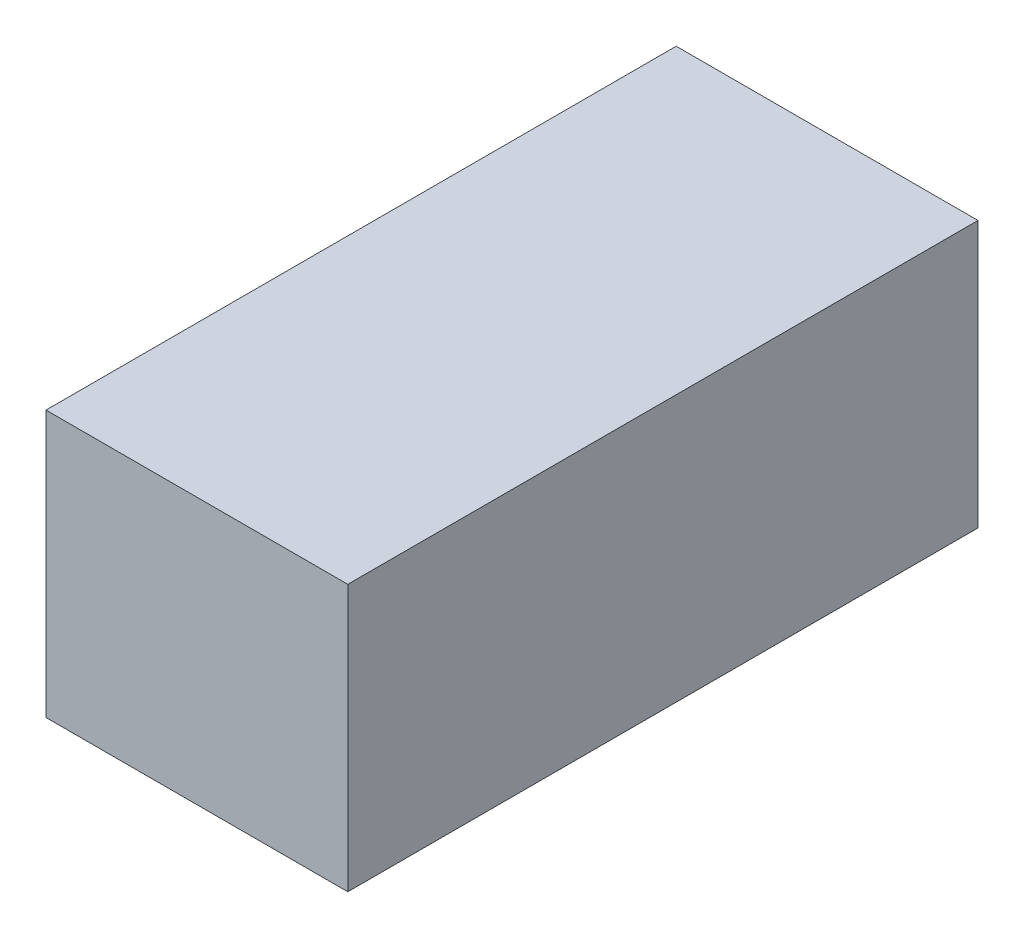
from build123d import *

# Parameters (mm, degrees)
SKETCH1_W           = 34
SKETCH1_H           = 30
BOSS_EXTRUDE1_DEPTH = 71


with BuildPart() as part:
    # Sketch1 → Boss-Extrude1 (new body)
    with BuildSketch(Plane.XY):
        with Locations((17, 15)):
            Rectangle(SKETCH1_W, SKETCH1_H)
    extrude(amount=BOSS_EXTRUDE1_DEPTH)


solid = part.part
